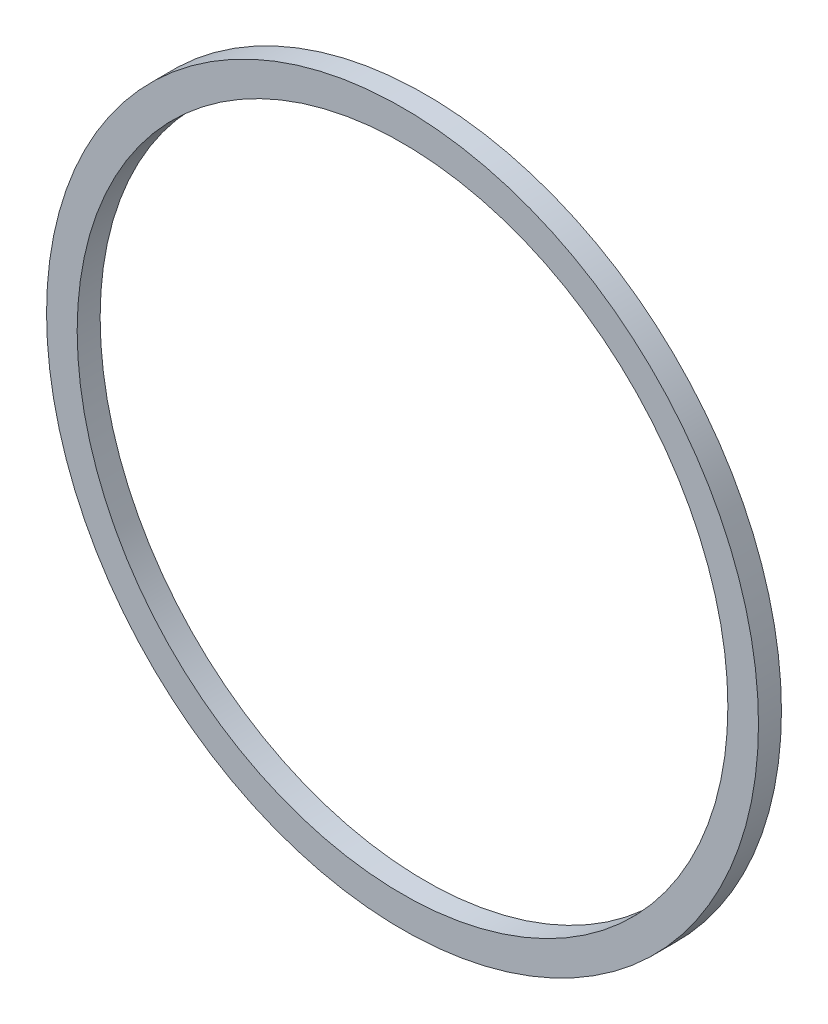
from build123d import *

# Parameters (mm, degrees)
SKETCH1_R           = 46.5
SKETCH1_R_2         = 42.5
BOSS_EXTRUDE1_DEPTH = 1.5


with BuildPart() as part:
    # Sketch1 → Boss-Extrude1 (new, symmetric)
    with BuildSketch(Plane.XY):
        Circle(SKETCH1_R)
        Circle(SKETCH1_R_2, mode=Mode.SUBTRACT)
    extrude(amount=BOSS_EXTRUDE1_DEPTH, both=True)


solid = part.part
